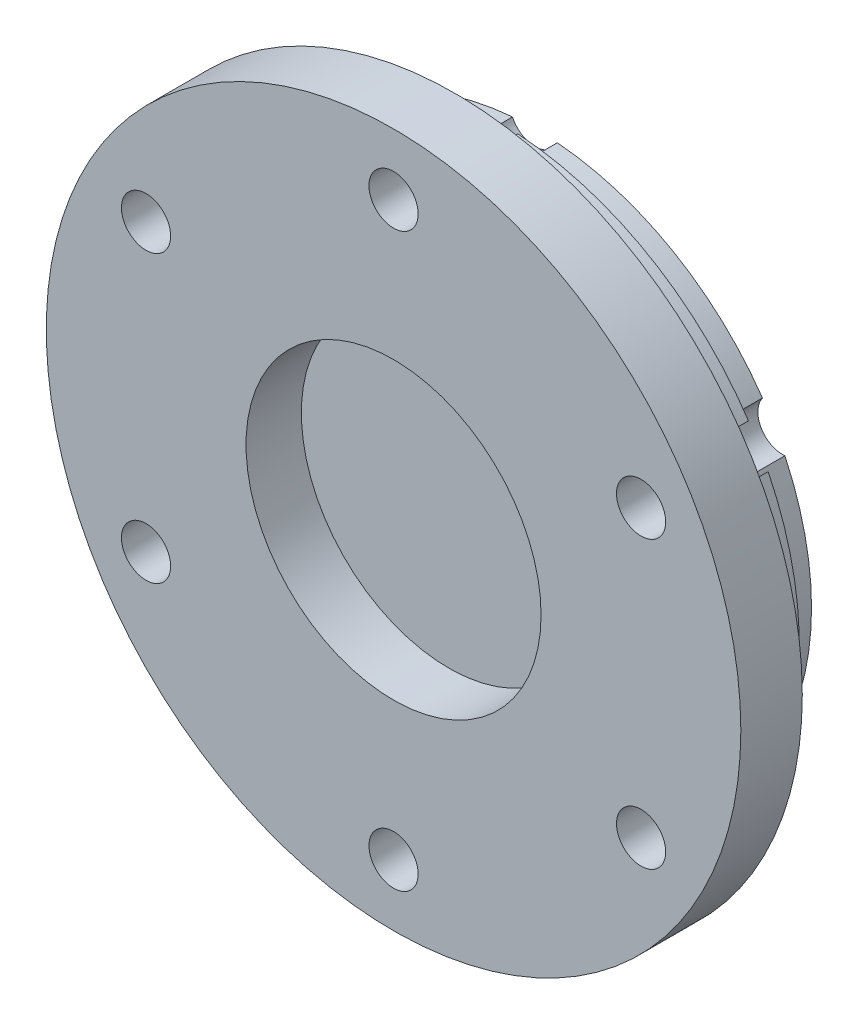
from build123d import *

# Parameters (mm, degrees)
SKETCH2_R          = 2
CUT_EXTRUDE1_DEPTH = 46.369317826
CIRPATTERN1_COUNT  = 6
SKETCH5_OUTSIDE_W  = 75.336
SKETCH5_OUTSIDE_H  = 75.336
SKETCH5_OUTSIDE_R  = 2
CUT_EXTRUDE2_DEPTH = 10
CIRPATTERN2_COUNT  = 6
SKETCH6_R          = 12
CUT_EXTRUDE3_DEPTH = 4.5
CUT_EXTRUDE4_DEPTH = 15


with BuildPart() as part:
    # Sketch1 → Revolve1 (revolve)
    with BuildSketch(Plane(origin=(0, 0, 0), x_dir=(0, 0, -1), z_dir=(1, 0, 0)), mode=Mode.PRIVATE) as revolve1_sk:
        Polygon((0, 0), (0, 28.25), (5, 28.25), (5, 24.5), (8.5, 24.5), (8.5, 22.5), (26.5, 22.5), (26.5, 0), align=None)
    revolve(revolve1_sk.sketch.rotate(Axis((0, 0, 0), (0, 0, -1)), 90), axis=Axis((0, 0, 0), (0, 0, -1)))

    # Sketch2 → Cut-Extrude1 (cut, symmetric)
    with BuildSketch(Plane(origin=(0, 0, -5), x_dir=(-1, 0, 0), z_dir=(0, 0, -1))):
        with Locations((0, 23.25)):
            Circle(SKETCH2_R)
    cut_extrude1 = extrude(amount=CUT_EXTRUDE1_DEPTH, both=True, mode=Mode.SUBTRACT)

    # CirPattern1: Cut-Extrude1 ×6 about axis
    cirpattern1_axis = Axis((0, 0, 0), (0, 0, 1))
    for i in range(1, CIRPATTERN1_COUNT):
        add(cut_extrude1.rotate(cirpattern1_axis, i * 360 / CIRPATTERN1_COUNT), mode=Mode.SUBTRACT)

    # Sketch5 outside → Cut-Extrude2 (cut)
    # profile 1 of 2: a face of its own
    with BuildSketch(Plane(origin=(0, 0, -26.5), x_dir=(-1, 0, 0), z_dir=(0, 0, -1))):
        Rectangle(SKETCH5_OUTSIDE_W, SKETCH5_OUTSIDE_H)
        with BuildLine():
            ThreePointArc((-1.822401722, 22.426075269), (-11.25, 19.485571585), (-18.510350029, 12.791283822))
            ThreePointArc((-18.510350029, 12.791283822), (-18.40303983, 10.625), (-20.332751751, 9.634791447))
            ThreePointArc((-20.332751751, 9.634791447), (-22.5, 0), (-20.332751751, -9.634791447))
            ThreePointArc((-20.332751751, -9.634791447), (-18.40303983, -10.625), (-18.510350029, -12.791283822))
            ThreePointArc((-18.510350029, -12.791283822), (-11.25, -19.485571585), (-1.822401722, -22.426075269))
            ThreePointArc((-1.822401722, -22.426075269), (0, -21.25), (1.822401722, -22.426075269))
            ThreePointArc((1.822401722, -22.426075269), (11.25, -19.485571585), (18.510350029, -12.791283822))
            ThreePointArc((18.510350029, -12.791283822), (18.40303983, -10.625), (20.332751751, -9.634791447))
            ThreePointArc((20.332751751, -9.634791447), (22.5, 0), (20.332751751, 9.634791447))
            ThreePointArc((20.332751751, 9.634791447), (18.40303983, 10.625), (18.510350029, 12.791283822))
            ThreePointArc((18.510350029, 12.791283822), (11.25, 19.485571585), (1.822401722, 22.426075269))
            ThreePointArc((1.822401722, 22.426075269), (0, 21.25), (-1.822401722, 22.426075269))
        make_face(mode=Mode.SUBTRACT)
    # profile 2 of 2: a face of its own
    with BuildSketch(Plane(origin=(0, 0, -26.5), x_dir=(-1, 0, 0), z_dir=(0, 0, -1))):
        with Locations((0, 17.5)):
            Circle(SKETCH5_OUTSIDE_R)
    cut_extrude2 = extrude(amount=-CUT_EXTRUDE2_DEPTH, mode=Mode.SUBTRACT)

    # CirPattern2: Cut-Extrude2 ×6 about axis
    cirpattern2_axis = Axis((0, 0, 0), (0, 0, 1))
    for i in range(1, CIRPATTERN2_COUNT):
        add(cut_extrude2.rotate(cirpattern2_axis, i * 360 / CIRPATTERN2_COUNT), mode=Mode.SUBTRACT)

    # Sketch6 → Cut-Extrude3 (cut)
    with BuildSketch(Plane.XY):
        Circle(SKETCH6_R)
    extrude(amount=-CUT_EXTRUDE3_DEPTH, mode=Mode.SUBTRACT)

    # Sketch7 → Cut-Extrude4 (cut)
    with BuildSketch(Plane(origin=(0, 0, -26.5), x_dir=(-1, 0, 0), z_dir=(0, 0, -1))):
        with BuildLine():
            ThreePointArc((-1.822401722, 22.426075269), (-11.25, 19.485571585), (-18.510350029, 12.791283822))
            ThreePointArc((-18.510350029, 12.791283822), (-18.40303983, 10.625), (-20.332751751, 9.634791447))
            ThreePointArc((-20.332751751, 9.634791447), (-22.5, 0), (-20.332751751, -9.634791447))
            ThreePointArc((-20.332751751, -9.634791447), (-18.40303983, -10.625), (-18.510350029, -12.791283822))
            ThreePointArc((-18.510350029, -12.791283822), (-11.25, -19.485571585), (-1.822401722, -22.426075269))
            ThreePointArc((-1.822401722, -22.426075269), (0, -21.25), (1.822401722, -22.426075269))
            ThreePointArc((1.822401722, -22.426075269), (11.25, -19.485571585), (18.510350029, -12.791283822))
            ThreePointArc((18.510350029, -12.791283822), (18.40303983, -10.625), (20.332751751, -9.634791447))
            ThreePointArc((20.332751751, -9.634791447), (22.5, 0), (20.332751751, 9.634791447))
            ThreePointArc((20.332751751, 9.634791447), (18.40303983, 10.625), (18.510350029, 12.791283822))
            ThreePointArc((18.510350029, 12.791283822), (11.25, 19.485571585), (1.822401722, 22.426075269))
            ThreePointArc((1.822401722, 22.426075269), (0, 21.25), (-1.822401722, 22.426075269))
        make_face()
    extrude(amount=-CUT_EXTRUDE4_DEPTH, mode=Mode.SUBTRACT)


solid = part.part
